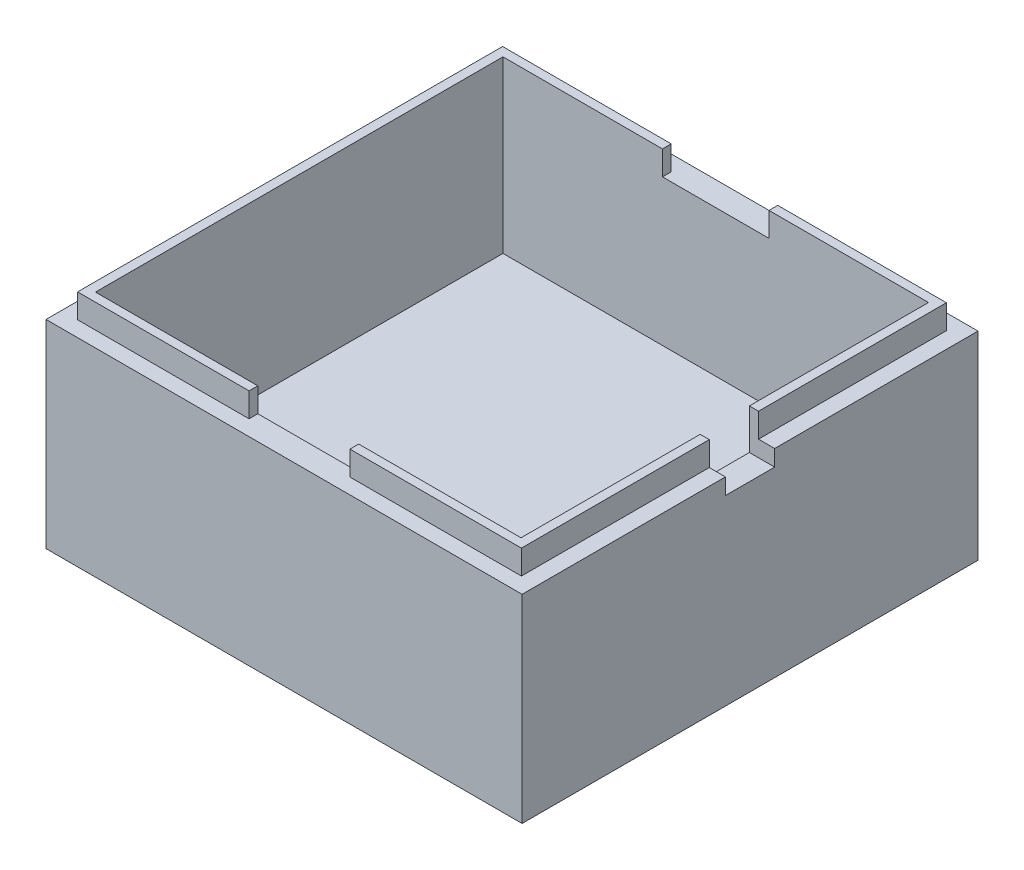
from build123d import *

# Parameters (mm, degrees)
SKETCH1_W           = 59
SKETCH1_H           = 56.5
BOSS_EXTRUDE1_DEPTH = 6.5
SKETCH5_W           = 59
SKETCH5_H           = 56.5
SKETCH5_W_2         = 52.734513274
SKETCH5_H_2         = 50.5
BOSS_EXTRUDE2_DEPTH = 21.1
SKETCH6_W           = 59
SKETCH6_H           = 56.5
SKETCH6_W_2         = 55
SKETCH6_H_2         = 52.669491526
CUT_EXTRUDE2_DEPTH  = 3
SKETCH7_W           = 12.5
SKETCH7_H           = 2.169491525
SKETCH7_W_2         = 13.2
SKETCH7_H_2         = 3.830508475
SKETCH7_W_3         = 2.265486726
SKETCH7_H_3         = 6.1
CUT_EXTRUDE3_DEPTH  = 3
SKETCH9_W           = 3.132743363
SKETCH9_H           = 6.1
CUT_EXTRUDE5_DEPTH  = 2
SKETCH11_R          = 1.8526
CUT_EXTRUDE7_DEPTH  = 10
SKETCH12_R          = 4.5
CUT_EXTRUDE8_DEPTH  = 4.5


with BuildPart() as part:
    # Sketch1 → Boss-Extrude1 (new body)
    with BuildSketch(Plane(origin=(0, 0, 0), x_dir=(1, 0, 0), z_dir=(0, 1, 0))):
        Rectangle(SKETCH1_W, SKETCH1_H)
    extrude(amount=BOSS_EXTRUDE1_DEPTH)

    # Sketch5 → Boss-Extrude2 (add)
    with BuildSketch(Plane(origin=(0, 6.5, 0), x_dir=(1, 0, 0), z_dir=(0, 1, 0))):
        Rectangle(SKETCH5_W, SKETCH5_H)
        Rectangle(SKETCH5_W_2, SKETCH5_H_2, mode=Mode.SUBTRACT)
    extrude(amount=BOSS_EXTRUDE2_DEPTH)

    # Sketch6 → Cut-Extrude2 (cut)
    with BuildSketch(Plane(origin=(0, 27.6, 0), x_dir=(1, 0, 0), z_dir=(0, 1, 0))):
        Rectangle(SKETCH6_W, SKETCH6_H)
        Rectangle(SKETCH6_W_2, SKETCH6_H_2, mode=Mode.SUBTRACT)
    extrude(amount=-CUT_EXTRUDE2_DEPTH, mode=Mode.SUBTRACT)

    # Sketch7 → Cut-Extrude3 (cut)
    with BuildSketch(Plane(origin=(0, 27.6, 0), x_dir=(1, 0, 0), z_dir=(0, 1, 0))):
        with Locations((0, -26.334745762)):
            Rectangle(SKETCH7_W, SKETCH7_H)
        with Locations((0, 26.334745762)):
            Rectangle(SKETCH7_W_2, SKETCH7_H_2)
        with Locations((26.367256637, 0)):
            Rectangle(SKETCH7_W_3, SKETCH7_H_3)
    extrude(amount=-CUT_EXTRUDE3_DEPTH, mode=Mode.SUBTRACT)

    # Sketch9 → Cut-Extrude5 (cut)
    with BuildSketch(Plane(origin=(0, 24.6, 0), x_dir=(1, 0, 0), z_dir=(0, 1, 0))):
        with Locations((27.933628319, 0)):
            Rectangle(SKETCH9_W, SKETCH9_H)
    extrude(amount=-CUT_EXTRUDE5_DEPTH, mode=Mode.SUBTRACT)

    # Sketch11 → Cut-Extrude7 (cut)
    with BuildSketch(Plane(origin=(0, 0, 0), x_dir=(-1, 0, 0), z_dir=(0, -1, 0))):
        with Locations(Location((-23, 21.75, 0), (0, 0, 90))):
            Circle(SKETCH11_R)
        with Locations(Location((23, -21.75, 0), (0, 0, 90))):
            Circle(SKETCH11_R)
    extrude(amount=-CUT_EXTRUDE7_DEPTH, mode=Mode.SUBTRACT)

    # Sketch12 → Cut-Extrude8 (cut)
    with BuildSketch(Plane.XZ):
        with Locations(Location((-23, 21.75, 0), (0, 0, 270))):
            Circle(SKETCH12_R)
        with Locations(Location((23, -21.75, 0), (0, 0, 270))):
            Circle(SKETCH12_R)
    extrude(amount=-CUT_EXTRUDE8_DEPTH, mode=Mode.SUBTRACT)


solid = part.part
